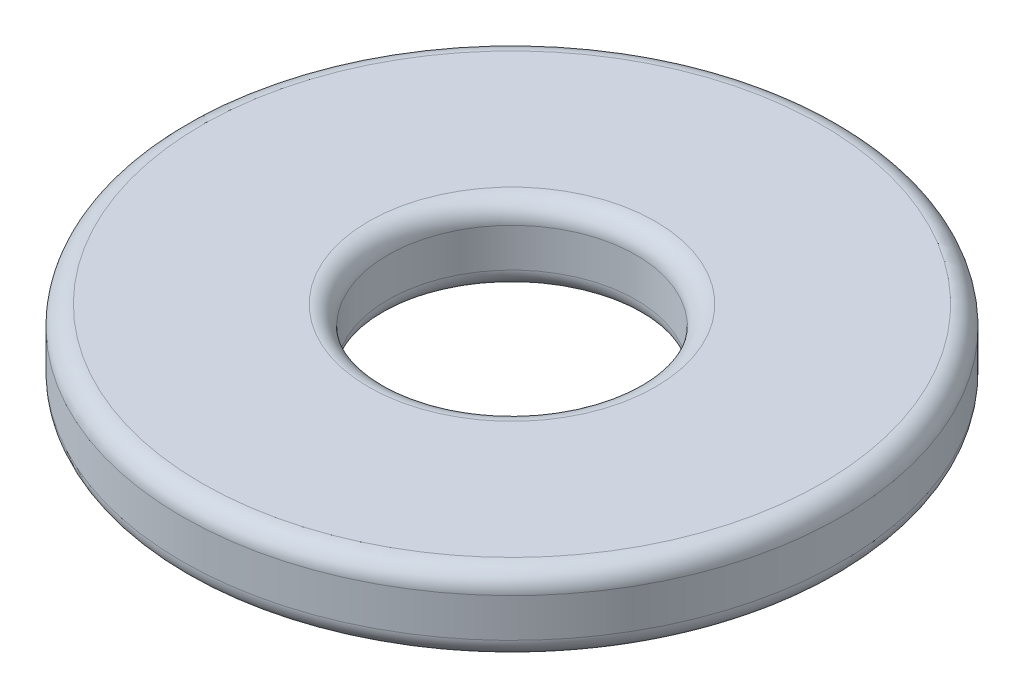
from build123d import *

# Parameters (mm, degrees)
SKETCH1_R           = 4.25
SKETCH1_R_2         = 1.6
BOSS_EXTRUDE1_DEPTH = 1
FILLET1_R           = 0.25
FILLET2_R           = 0.25


with BuildPart() as part:
    # Sketch1 → Boss-Extrude1 (new body)
    with BuildSketch(Plane(origin=(0, 0, 0), x_dir=(1, 0, 0), z_dir=(0, 1, 0))):
        with Locations(Location((0, 0, 0), (0, 0, 270))):
            Circle(SKETCH1_R)
        with Locations(Location((0, 0, 0), (0, 0, 270))):
            Circle(SKETCH1_R_2, mode=Mode.SUBTRACT)
    extrude(amount=BOSS_EXTRUDE1_DEPTH)

    # Fillet1
    fillet1_edges = [part.edges().sort_by_distance(p)[0] for p in [
        (0, 1, -4.25),
        (0, 0, -4.25),
    ]]
    fillet(fillet1_edges, radius=FILLET1_R)

    # Fillet2
    fillet2_edges = [part.edges().sort_by_distance(p)[0] for p in [
        (0, 0, -1.6),
        (0, 1, -1.6),
    ]]
    fillet(fillet2_edges, radius=FILLET2_R)


solid = part.part
